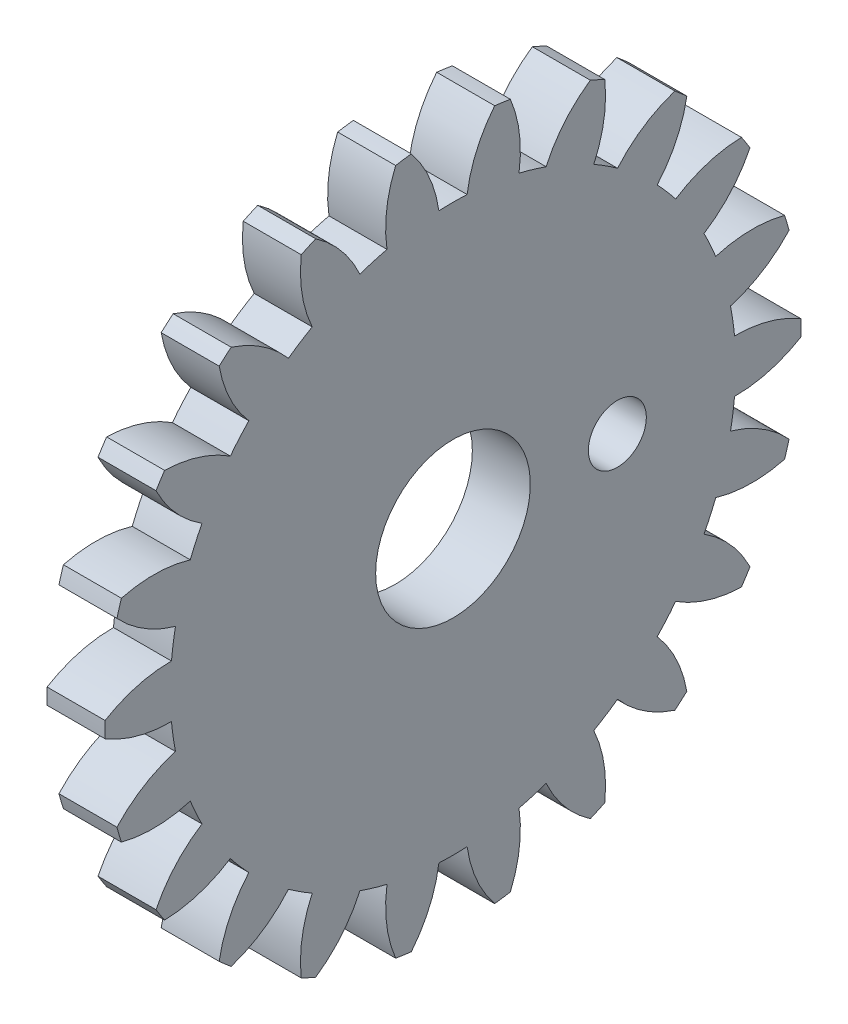
from build123d import *

# Parameters (mm, degrees)
BASPROSKE_W         = 3
BASPROSKE_H         = 18
TOOTHCUT_DEPTH      = 26.632011236
TEETHCUTS_COUNT     = 22
TEETHCUTS_ANGLE     = 343.636363636
BORSKE_R            = 4
BORE_DEPTH          = 50.0000508
SKETCH_1_R          = 1.5
CUT_EXTRUDE_1_DEPTH = 26.541251799


with BuildPart() as part:
    # BasProSke → Base-Revolve (revolve)
    with BuildSketch(Plane(origin=(0, 0, 0), x_dir=(1, 0, 0), z_dir=(0, 1, 0)), mode=Mode.PRIVATE) as base_revolve_sk:
        with Locations((1.5, 9)):
            Rectangle(BASPROSKE_W, BASPROSKE_H)
    revolve(base_revolve_sk.sketch.rotate(Axis((-10, 0, 0), (1, 0, 0)), 180), axis=Axis((-10, 0, 0), (1, 0, 0)))

    # TooCutSke → ToothCut (cut, through all)
    with BuildSketch(Plane(origin=(0, 0, 0), x_dir=(0, 0, -1), z_dir=(1, 0, 0))):
        with BuildLine():
            ThreePointArc((0.730362564, 14.605750461), (0, 14.624), (-0.730362564, 14.605750461))
            ThreePointArc((-0.730362564, 14.605750461), (-1.224349384, 16.349859844), (-2.174192494, 17.893795913))
            ThreePointArc((-2.174192494, 17.893795913), (0, 18.0254), (2.174192494, 17.893795913))
            ThreePointArc((2.174192494, 17.893795913), (1.224349384, 16.349859844), (0.730362564, 14.605750461))
        make_face()
    toothcut = extrude(amount=TOOTHCUT_DEPTH, mode=Mode.SUBTRACT)

    # TeethCuts: ToothCut ×22 about axis
    teethcuts_axis = Axis((-10, 0, 0), (1, 0, 0))
    for i in range(1, TEETHCUTS_COUNT):
        add(toothcut.rotate(teethcuts_axis, i * TEETHCUTS_ANGLE / (TEETHCUTS_COUNT - 1)), mode=Mode.SUBTRACT)

    # BorSke → Bore (cut, symmetric)
    with BuildSketch(Plane(origin=(0, 0, 0), x_dir=(0, 0, -1), z_dir=(1, 0, 0))):
        with Locations(Location((0, 0, 0), (0, 0, 180))):
            Circle(BORSKE_R)
    extrude(amount=BORE_DEPTH, both=True, mode=Mode.SUBTRACT)

    # 草图1 → 切除-拉伸1 (cut, through all)
    with BuildSketch(Plane(origin=(3, 0, 0), x_dir=(0, 0, -1), z_dir=(1, 0, 0))):
        with Locations((8.5, 0)):
            Circle(SKETCH_1_R)
    extrude(amount=-CUT_EXTRUDE_1_DEPTH, mode=Mode.SUBTRACT)


solid = part.part
